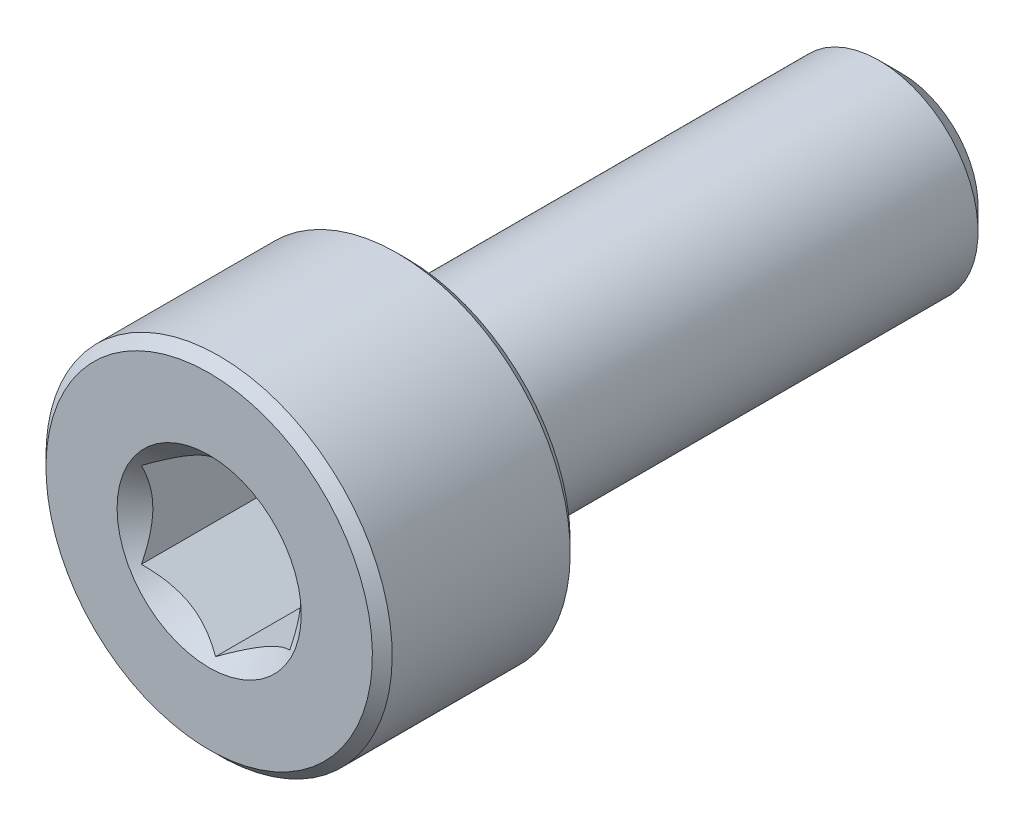
from build123d import *

# Parameters (mm, degrees)
CUT_EXTRUDE1_DEPTH = 3


with BuildPart() as part:
    # Sketch2 → Revolve1 (revolve)
    with BuildSketch(Plane(origin=(0, 0, 0), x_dir=(0, 0, -1), z_dir=(1, 0, 0))):
        with BuildLine():
            Line((-7, 0), (-7, 3.3))
            Line((-7, 3.3), (-6.8, 3.5))
            Line((-6.8, 3.5), (-3.2, 3.5))
            Line((-3.2, 3.5), (-3, 3.3))
            Line((-3, 3.3), (-3, 2.2))
            ThreePointArc((-3, 2.2), (-2.941421356, 2.058578644), (-2.8, 2))
            Line((-2.8, 2), (6.545336663, 2))
            Line((6.545336663, 2), (7, 1.545336663))
            Line((7, 1.545336663), (7, 0))
            Line((7, 0), (-7, 0))
        make_face()
    revolve(axis=Axis((0, 0, -7), (0, 0, 1)))

    # Sketch3 → Cut-Extrude1 (cut)
    with BuildSketch(Plane.XY.offset(7)):
        Polygon((1.5, -0.866025404), (1.5, 0.866025404), (0, 1.732050808), (-1.5, 0.866025404), (-1.5, -0.866025404), (0, -1.732050808), align=None)
    extrude(amount=-CUT_EXTRUDE1_DEPTH, mode=Mode.SUBTRACT)

    # Cut-Extrude2 cone 1 section (through the dimple's axis) → Cut-Extrude2 (revolve, cut)
    with BuildSketch(Plane(origin=(0, 0, 7), x_dir=(0, -1, 0), z_dir=(1, 0, 0))):
        Polygon((0, 0), (1.861954618, 0), (0, 1.861954618), align=None)
    revolve(axis=Axis((0, 0, 7), (0, 0, -1)), mode=Mode.SUBTRACT)


solid = part.part
